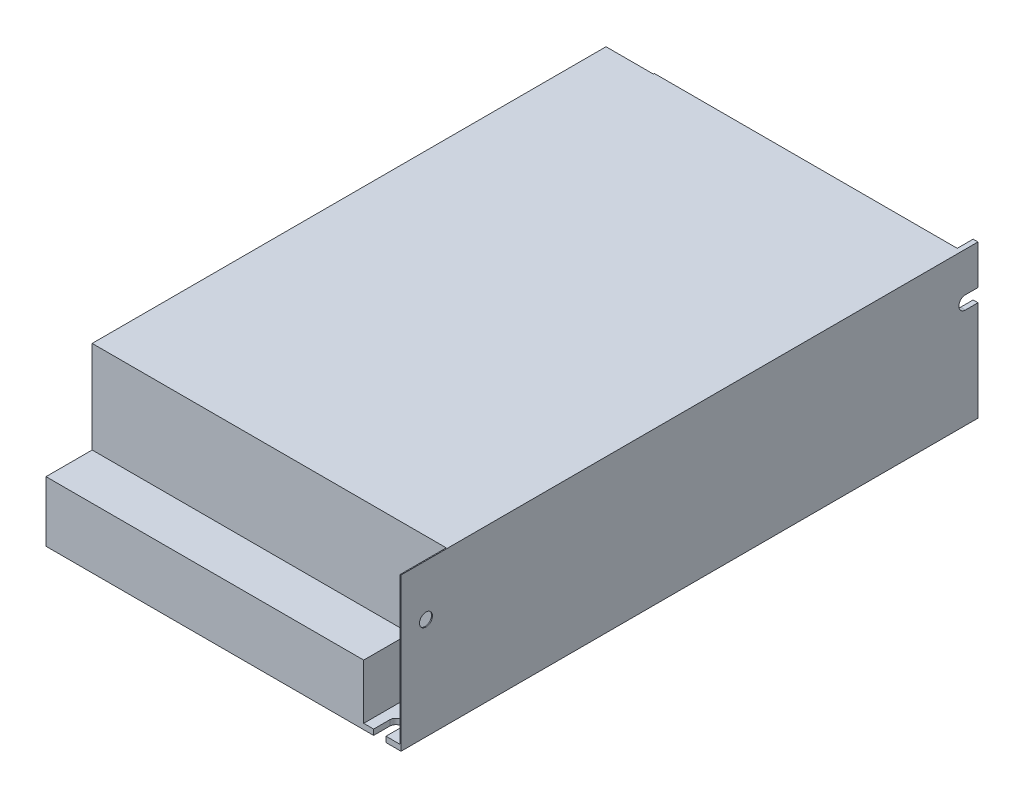
from build123d import *

# Parameters (mm, degrees)
SKETCH1_W           = 97.6884
SKETCH1_H           = 158.75
BOSS_EXTRUDE1_DEPTH = 42
CUT_EXTRUDE1_START  = -97.6884
SKETCH2_W           = 12.7
SKETCH2_H           = 25.4
CUT_EXTRUDE1_DEPTH  = 97.4344
SKETCH3_W           = 10.0203
SKETCH3_H           = 10.1346
CUT_EXTRUDE2_DEPTH  = 15.076
SKETCH4_W           = 13.0175
SKETCH4_H           = 4.6609
CUT_EXTRUDE3_DEPTH  = 40.476
SKETCH5_W           = 12.5095
SKETCH5_H           = 7.62
CUT_EXTRUDE4_DEPTH  = 7.62
SKETCH6_W           = 96.3549
SKETCH6_H           = 4.3815
CUT_EXTRUDE5_DEPTH  = 30.2133
CUT_EXTRUDE6_DEPTH  = 191.743001367
CUT_EXTRUDE7_DEPTH  = 1.3335
SKETCH9_R           = 1.778
CUT_EXTRUDE8_DEPTH  = 0.254
CUT_EXTRUDE9_DEPTH  = 1.524


with BuildPart() as part:
    # Sketch1 → Boss-Extrude1 (new body)
    with BuildSketch(Plane(origin=(0, 0, 0), x_dir=(1, 0, 0), z_dir=(0, 1, 0))):
        with Locations((48.8442, 79.375)):
            Rectangle(SKETCH1_W, SKETCH1_H)
    extrude(amount=BOSS_EXTRUDE1_DEPTH)

    # Sketch2 → Cut-Extrude1 (cut)
    with BuildSketch(Plane(origin=(97.6884, 0, 0), x_dir=(0, 0, -1), z_dir=(1, 0, 0)).offset(CUT_EXTRUDE1_START)):
        with Locations((6.35, 29.3)):
            Rectangle(SKETCH2_W, SKETCH2_H)
    extrude(amount=CUT_EXTRUDE1_DEPTH, mode=Mode.SUBTRACT)

    # Sketch3 → Cut-Extrude2 (cut)
    with BuildSketch(Plane(origin=(0, 16.6, 0), x_dir=(1, 0, 0), z_dir=(0, 1, 0))):
        with Locations((92.42425, 5.0673)):
            Rectangle(SKETCH3_W, SKETCH3_H)
    extrude(amount=-CUT_EXTRUDE2_DEPTH, mode=Mode.SUBTRACT)

    # Sketch4 → Cut-Extrude3 (cut)
    with BuildSketch(Plane(origin=(0, 42, 0), x_dir=(1, 0, 0), z_dir=(0, 1, 0))):
        with Locations((6.50875, 156.41955)):
            Rectangle(SKETCH4_W, SKETCH4_H)
    extrude(amount=-CUT_EXTRUDE3_DEPTH, mode=Mode.SUBTRACT)

    # Sketch5 → Cut-Extrude4 (cut)
    with BuildSketch(Plane(origin=(0, 1.524, 0), x_dir=(1, 0, 0), z_dir=(0, 1, 0))):
        with Locations((6.76275, 154.94)):
            Rectangle(SKETCH5_W, SKETCH5_H)
    extrude(amount=CUT_EXTRUDE4_DEPTH, mode=Mode.SUBTRACT)

    # Sketch6 → Cut-Extrude5 (cut)
    with BuildSketch(Plane(origin=(0, 42, 0), x_dir=(1, 0, 0), z_dir=(0, 1, 0))):
        with Locations((48.17745, 156.55925)):
            Rectangle(SKETCH6_W, SKETCH6_H)
    extrude(amount=-CUT_EXTRUDE5_DEPTH, mode=Mode.SUBTRACT)

    # Sketch7 → Cut-Extrude6 (cut, through all)
    with BuildSketch(Plane(origin=(0, 1.524, 0), x_dir=(1, 0, 0), z_dir=(0, 1, 0))):
        with BuildLine():
            Line((5.08, 158.75), (5.08, 154.813))
            ThreePointArc((5.08, 154.813), (6.6675, 153.2255), (8.255, 154.813))
            Line((8.255, 154.813), (8.255, 158.75))
            Line((8.255, 158.75), (5.08, 158.75))
        make_face()
    extrude(amount=-CUT_EXTRUDE6_DEPTH, mode=Mode.SUBTRACT)

    # Sketch8 → Cut-Extrude7 (cut)
    with BuildSketch(Plane(origin=(97.6884, 0, 0), x_dir=(0, 0, -1), z_dir=(1, 0, 0))):
        with BuildLine():
            Line((158.75, 31.1288), (155.2829, 31.1288))
            ThreePointArc((155.2829, 31.1288), (153.47315, 29.31905), (155.2829, 27.5093))
            Line((155.2829, 27.5093), (158.75, 27.5093))
            Line((158.75, 27.5093), (158.75, 31.1288))
        make_face()
    extrude(amount=-CUT_EXTRUDE7_DEPTH, mode=Mode.SUBTRACT)

    # Sketch9 → Cut-Extrude8 (cut)
    with BuildSketch(Plane(origin=(97.6884, 0, 0), x_dir=(0, 0, -1), z_dir=(1, 0, 0))):
        with Locations((6.858, 27.9665)):
            Circle(SKETCH9_R)
    extrude(amount=-CUT_EXTRUDE8_DEPTH, mode=Mode.SUBTRACT)

    # Sketch10 → Cut-Extrude9 (cut)
    with BuildSketch(Plane.XZ):
        with BuildLine():
            Line((93.5482, 0), (90.1446, 0))
            Line((90.1446, 0), (90.1446, -4.445))
            ThreePointArc((90.1446, -4.445), (91.8464, -6.1468), (93.5482, -4.445))
            Line((93.5482, -4.445), (93.5482, 0))
        make_face()
    extrude(amount=-CUT_EXTRUDE9_DEPTH, mode=Mode.SUBTRACT)


solid = part.part
